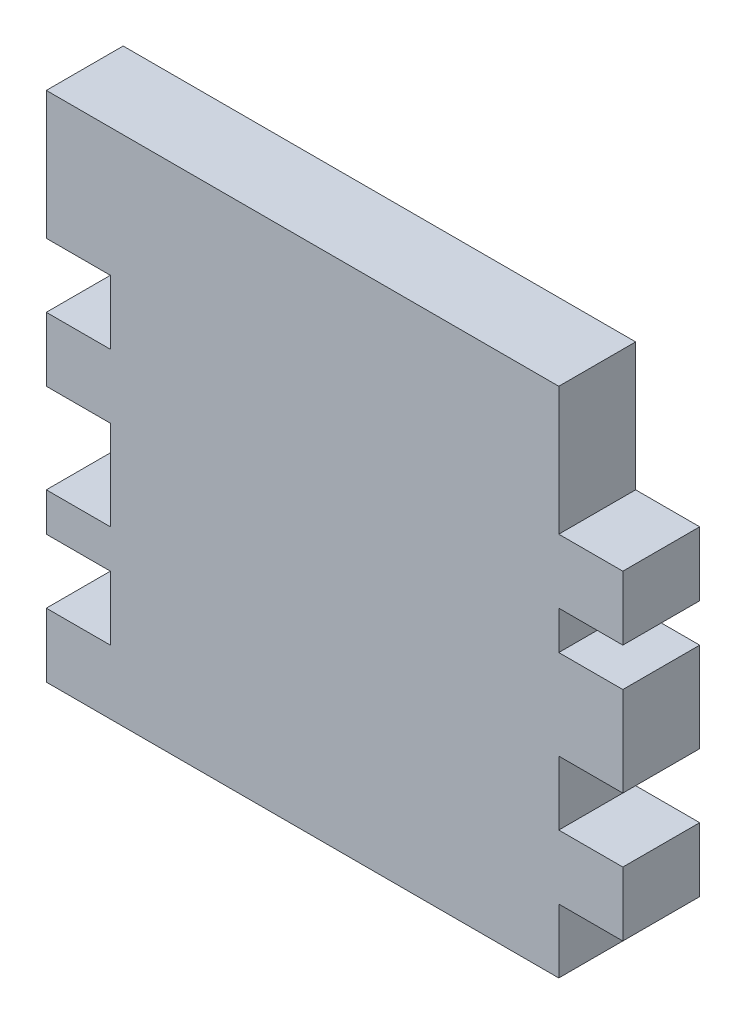
from build123d import *

# Parameters (mm, degrees)
SKETCH1_W           = 45
SKETCH1_H           = 40
BOSS_EXTRUDE1_DEPTH = 6
SKETCH2_W           = 5
SKETCH2_H           = 5
SKETCH2_H_2         = 7
CUT_EXTRUDE1_DEPTH  = 6
SKETCH3_W           = 5
SKETCH3_H           = 5
SKETCH3_H_2         = 7
CUT_EXTRUDE3_DEPTH  = 6
SKETCH3_4_W         = 5
SKETCH3_4_H         = 5
SKETCH3_4_H_2       = 7
BOSS_EXTRUDE3_DEPTH = 6
SKETCH3_5_W         = 5
SKETCH3_5_H         = 3
SKETCH3_5_H_2       = 10
SKETCH3_5_H_3       = 5
CUT_EXTRUDE4_DEPTH  = 6


with BuildPart() as part:
    # Sketch1 → Boss-Extrude1 (new body)
    with BuildSketch(Plane.XY):
        with Locations((4.06626506, -2.515060241)):
            Rectangle(SKETCH1_W, SKETCH1_H)
    extrude(amount=BOSS_EXTRUDE1_DEPTH)

    # Sketch2 → Cut-Extrude1 (cut)
    with BuildSketch(Plane.XY.offset(6)):
        with Locations((-15.93373494, 4.984939759)):
            Rectangle(SKETCH2_W, SKETCH2_H)
        with Locations((-15.93373494, -6.015060241)):
            Rectangle(SKETCH2_W, SKETCH2_H_2)
        with Locations((-15.93373494, -15.015060241)):
            Rectangle(SKETCH2_W, SKETCH2_H)
    extrude(amount=-CUT_EXTRUDE1_DEPTH, mode=Mode.SUBTRACT)

    # Sketch3 → Cut-Extrude3 (cut)
    with BuildSketch(Plane.XY.offset(6)):
        with Locations((24.06626506, 4.984939759)):
            Rectangle(SKETCH3_W, SKETCH3_H)
        with Locations((24.06626506, -4.015060241)):
            Rectangle(SKETCH3_W, SKETCH3_H_2)
        with Locations((24.06626506, -15.015060241)):
            Rectangle(SKETCH3_W, SKETCH3_H)
    extrude(amount=-CUT_EXTRUDE3_DEPTH, mode=Mode.SUBTRACT)

    # Sketch3<4> → Boss-Extrude3 (add)
    with BuildSketch(Plane.XY.offset(6)):
        with Locations((24.06626506, 4.984939759)):
            Rectangle(SKETCH3_4_W, SKETCH3_4_H)
        with Locations((24.06626506, -4.015060241)):
            Rectangle(SKETCH3_4_W, SKETCH3_4_H_2)
        with Locations((24.06626506, -15.015060241)):
            Rectangle(SKETCH3_4_W, SKETCH3_4_H)
    extrude(amount=-BOSS_EXTRUDE3_DEPTH)

    # Sketch3<5> → Cut-Extrude4 (cut)
    with BuildSketch(Plane.XY.offset(6)):
        with Locations((24.06626506, 0.984939759)):
            Rectangle(SKETCH3_5_W, SKETCH3_5_H)
        with Locations((24.06626506, 12.484939759)):
            Rectangle(SKETCH3_5_W, SKETCH3_5_H_2)
        with Locations((24.06626506, -10.015060241)):
            Rectangle(SKETCH3_5_W, SKETCH3_5_H_3)
        with Locations((24.06626506, -20.015060241)):
            Rectangle(SKETCH3_5_W, SKETCH3_5_H_3)
    extrude(amount=-CUT_EXTRUDE4_DEPTH, mode=Mode.SUBTRACT)


solid = part.part
